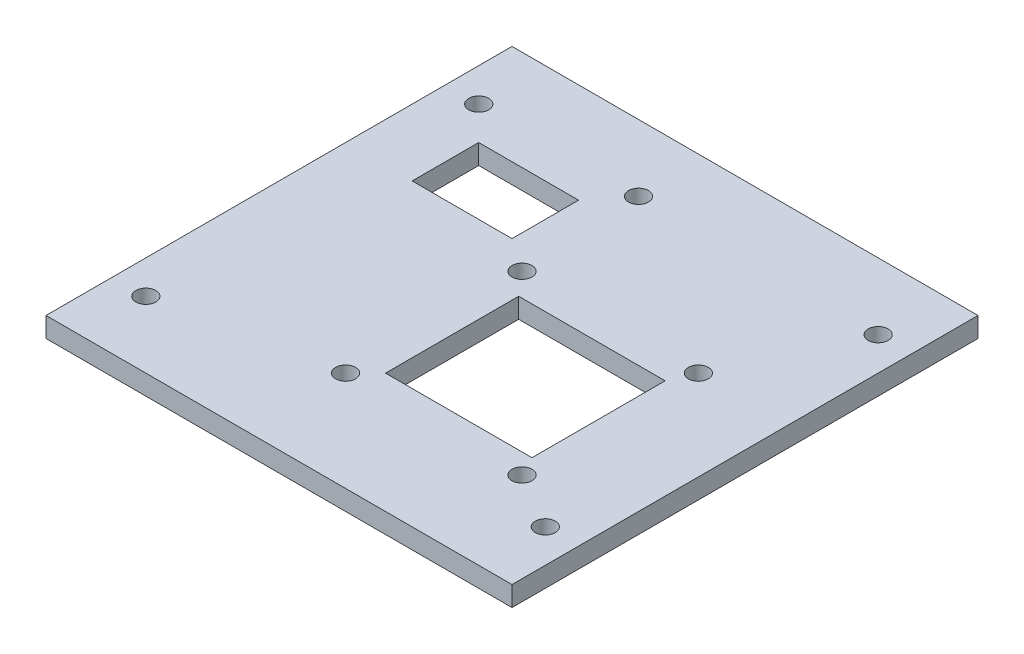
from build123d import *

# Parameters (mm, degrees)
SKETCH1_W           = 70
SKETCH1_H           = 70
BOSS_EXTRUDE1_DEPTH = 3
SKETCH2_R           = 1.5
CUT_EXTRUDE1_DEPTH  = 3
SKETCH3_R           = 1.5
SKETCH3_W           = 15
SKETCH3_H           = 10
SKETCH3_W_2         = 22
SKETCH3_H_2         = 20
CUT_EXTRUDE2_DEPTH  = 3


with BuildPart() as part:
    # Sketch1 → Boss-Extrude1 (new body)
    with BuildSketch(Plane(origin=(0, 0, 0), x_dir=(1, 0, 0), z_dir=(0, 1, 0))):
        Rectangle(SKETCH1_W, SKETCH1_H)
    extrude(amount=BOSS_EXTRUDE1_DEPTH)

    # Sketch2 → Cut-Extrude1 (cut)
    with BuildSketch(Plane(origin=(0, 3, 0), x_dir=(1, 0, 0), z_dir=(0, 1, 0))):
        with Locations(Location((-30, 25, 0), (0, 0, 270))):
            Circle(SKETCH2_R)
        with Locations(Location((30, 25, 0), (0, 0, 90))):
            Circle(SKETCH2_R)
        with Locations(Location((30, -25, 0), (0, 0, 270))):
            Circle(SKETCH2_R)
        with Locations(Location((-30, -25, 0), (0, 0, 90))):
            Circle(SKETCH2_R)
    extrude(amount=-CUT_EXTRUDE1_DEPTH, mode=Mode.SUBTRACT)

    # Sketch3 → Cut-Extrude2 (cut)
    with BuildSketch(Plane(origin=(0, 3, 0), x_dir=(1, 0, 0), z_dir=(0, 1, 0))):
        with Locations(Location((21.5, 6.5, 0), (0, 0, 270))):
            Circle(SKETCH3_R)
        with Locations(Location((21.5, -20, 0), (0, 0, 90))):
            Circle(SKETCH3_R)
        with Locations(Location((-5, -20, 0), (0, 0, 270))):
            Circle(SKETCH3_R)
        with Locations(Location((-6, 25, 0), (0, 0, 270))):
            Circle(SKETCH3_R)
        with Locations(Location((-5, 6.5, 0), (0, 0, 90))):
            Circle(SKETCH3_R)
        with Locations((-17.5, 15)):
            Rectangle(SKETCH3_W, SKETCH3_H)
        with Locations((9, -7)):
            Rectangle(SKETCH3_W_2, SKETCH3_H_2)
    extrude(amount=-CUT_EXTRUDE2_DEPTH, mode=Mode.SUBTRACT)


solid = part.part
